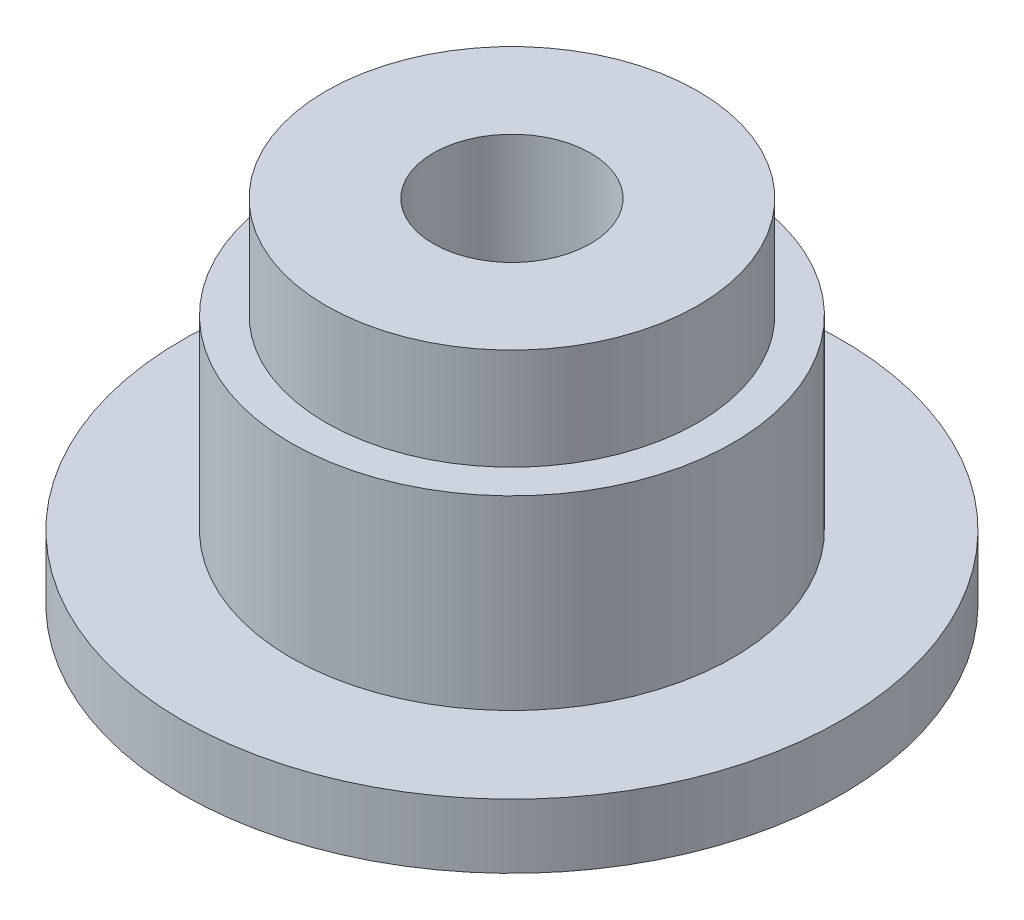
from build123d import *

# Parameters (mm, degrees)
SKETCH1_R           = 11
SKETCH1_R_2         = 4.65
BOSS_EXTRUDE1_DEPTH = 17
SKETCH1_5_R         = 13.075
SKETCH1_5_R_2       = 11
BOSS_EXTRUDE2_DEPTH = 11
BOSS_EXTRUDE3_START = 3.8
SKETCH2_R           = 19.5
SKETCH2_R_2         = 4.65
BOSS_EXTRUDE3_DEPTH = 3.8


with BuildPart() as part:
    # Sketch1 → Boss-Extrude1 (new body)
    with BuildSketch(Plane(origin=(0, 0, 0), x_dir=(1, 0, 0), z_dir=(0, 1, 0))):
        Circle(SKETCH1_R)
        Circle(SKETCH1_R_2, mode=Mode.SUBTRACT)
    extrude(amount=BOSS_EXTRUDE1_DEPTH)

    # Sketch1<5> → Boss-Extrude2 (add)
    with BuildSketch(Plane(origin=(0, 0, 0), x_dir=(1, 0, 0), z_dir=(0, 1, 0))):
        Circle(SKETCH1_5_R)
        Circle(SKETCH1_5_R_2, mode=Mode.SUBTRACT)
    extrude(amount=BOSS_EXTRUDE2_DEPTH)

    # Sketch2 → Boss-Extrude3 (add)
    with BuildSketch(Plane.XZ.offset(BOSS_EXTRUDE3_START)):
        Circle(SKETCH2_R)
        Circle(SKETCH2_R_2, mode=Mode.SUBTRACT)
    extrude(amount=-BOSS_EXTRUDE3_DEPTH)


solid = part.part
